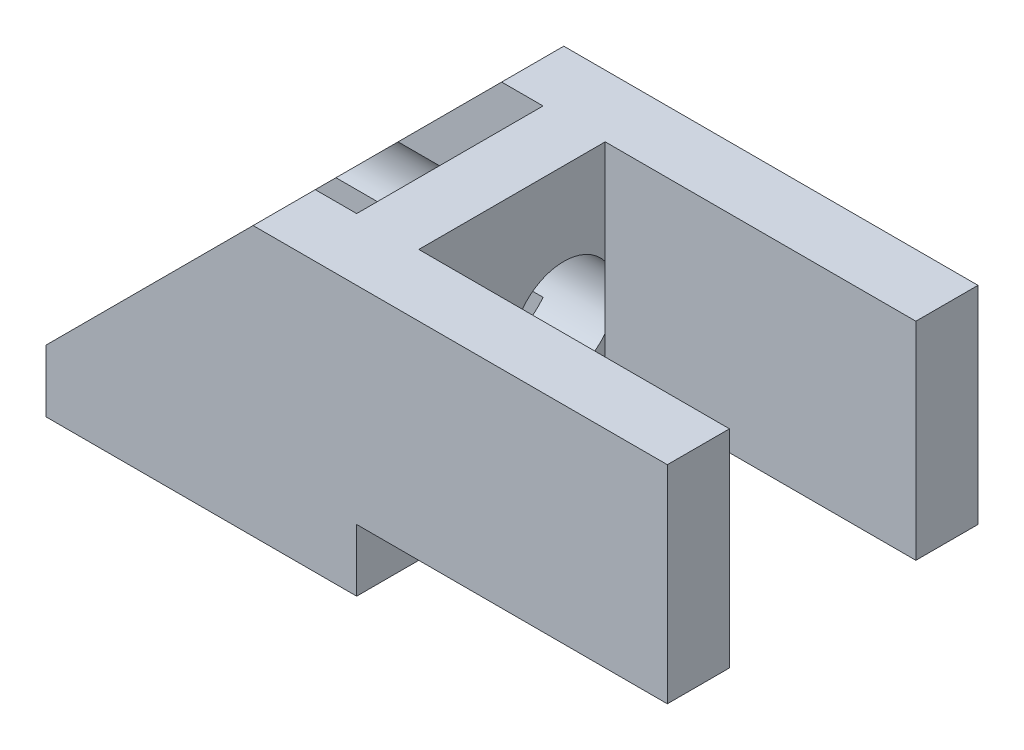
from build123d import *

# Parameters (mm, degrees)
SKETCH2_W           = 15
SKETCH2_H           = 15
BOSS_EXTRUDE1_DEPTH = 3
BOSS_EXTRUDE2_DEPTH = 3
SKETCH5_W           = 9
SKETCH5_H           = 10
BOSS_EXTRUDE4_DEPTH = 3
CUT_EXTRUDE1_REACH  = 26.88
SKETCH6_R           = 2.5


with BuildPart() as part:
    # Sketch2 → Boss-Extrude1 (new body)
    with BuildSketch(Plane(origin=(0, 0, 0), x_dir=(1, 0, 0), z_dir=(0, 1, 0))):
        with Locations((7.5, 7.5)):
            Rectangle(SKETCH2_W, SKETCH2_H)
    extrude(amount=BOSS_EXTRUDE1_DEPTH)

    # Sketch3 → Boss-Extrude2 (add)
    with BuildSketch(Plane.XY):
        Polygon((0, 3), (10, 13), (30, 13), (30, 3), align=None)
    boss_extrude2 = extrude(amount=-BOSS_EXTRUDE2_DEPTH)

    # Mirror1: Boss-Extrude2 across plane
    add(boss_extrude2.mirror(Plane.XY.offset(-7.5)))

    # Sketch5 → Boss-Extrude4 (add)
    with BuildSketch(Plane(origin=(15, 0, 0), x_dir=(0, 0, -1), z_dir=(1, 0, 0))):
        with Locations((7.5, 8)):
            Rectangle(SKETCH5_W, SKETCH5_H)
    extrude(amount=-BOSS_EXTRUDE4_DEPTH)

    # Sketch6 → Cut-Extrude1 (cut, up to next)
    with BuildSketch(Plane(origin=(15, 0, 0), x_dir=(0, 0, -1), z_dir=(1, 0, 0)), mode=Mode.PRIVATE) as cut_extrude1_sk1:
        with Locations(Location((10, 6.5, 0), (0, 0, 323.130102354))):
            Circle(SKETCH6_R)
    cut_extrude1_tool1 = extrude(cut_extrude1_sk1.sketch, amount=-CUT_EXTRUDE1_REACH, mode=Mode.PRIVATE) & part.part
    add(cut_extrude1_tool1.solids().sort_by_distance((15, 6.5, -10))[0], mode=Mode.SUBTRACT)


solid = part.part
